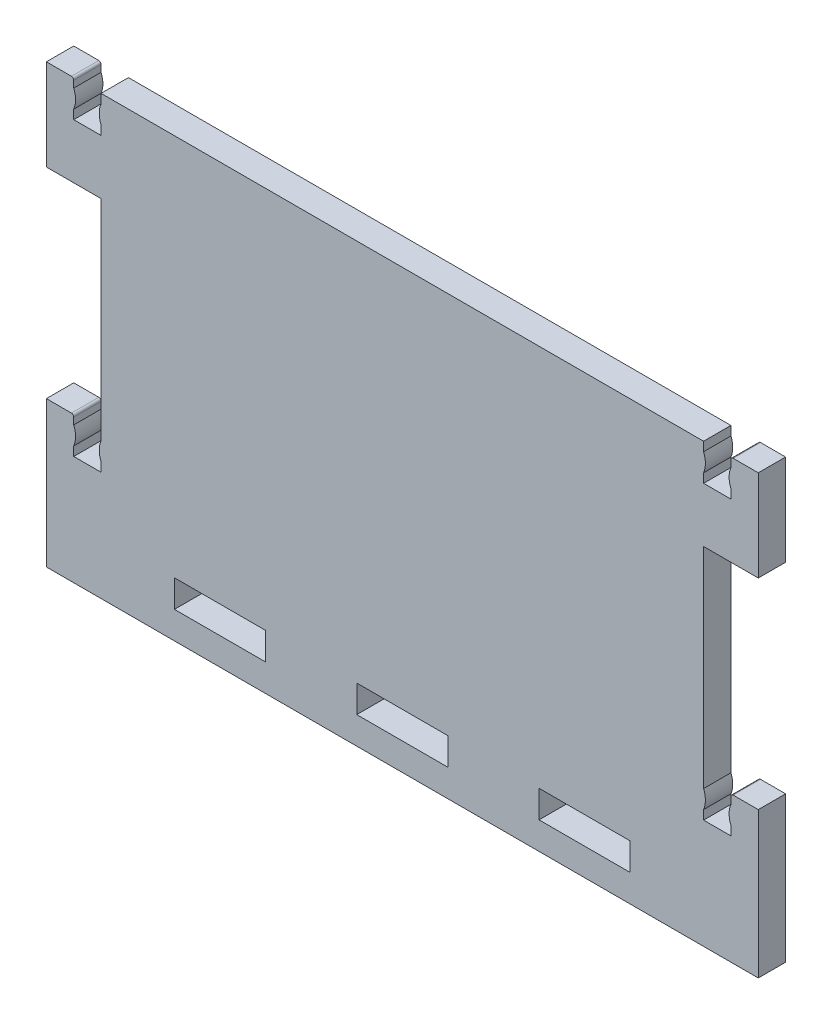
from build123d import *

# Parameters (mm, degrees)
SKETCH1_W           = 10
SKETCH1_H           = 3
BOSS_EXTRUDE1_DEPTH = 3
FILLET1_R           = 0.25


with BuildPart() as part:
    # Sketch1 → Boss-Extrude1 (new body)
    with BuildSketch(Plane.XY):
        with BuildLine():
            Line((34.843392212, -14.218278754), (31.843392212, -14.218278754))
            Line((31.843392212, -14.218278754), (31.843392212, -13.218278754))
            ThreePointArc((31.843392212, -13.218278754), (32.043392212, -12.218278754), (31.843392212, -11.218278754))
            Line((31.843392212, -11.218278754), (31.843392212, 11.781721246))
            Line((31.843392212, 11.781721246), (37.843392212, 11.781721246))
            Line((37.843392212, 11.781721246), (37.843392212, 21.781721246))
            Line((37.843392212, 21.781721246), (34.843392212, 21.781721246))
            Line((34.843392212, 21.781721246), (34.843392212, 20.781721246))
            ThreePointArc((34.843392212, 20.781721246), (34.643392212, 19.781721246), (34.843392212, 18.781721246))
            Line((34.843392212, 18.781721246), (34.843392212, 17.781721246))
            Line((34.843392212, 17.781721246), (31.843392212, 17.781721246))
            Line((31.843392212, 17.781721246), (31.843392212, 18.781721246))
            ThreePointArc((31.843392212, 18.781721246), (32.043392212, 19.781721246), (31.843392212, 20.781721246))
            Line((31.843392212, 20.781721246), (31.843392212, 21.781721246))
            Line((31.843392212, 21.781721246), (-34.256607788, 21.781721246))
            Line((-34.256607788, 21.781721246), (-34.256607788, 20.781721246))
            ThreePointArc((-34.256607788, 20.781721246), (-34.456607788, 19.781721246), (-34.256607788, 18.781721246))
            Line((-34.256607788, 18.781721246), (-34.256607788, 17.781721246))
            Line((-34.256607788, 17.781721246), (-37.256607788, 17.781721246))
            Line((-37.256607788, 17.781721246), (-37.256607788, 18.781721246))
            ThreePointArc((-37.256607788, 18.781721246), (-37.056607788, 19.781721246), (-37.256607788, 20.781721246))
            Line((-37.256607788, 20.781721246), (-37.256607788, 21.781721246))
            Line((-37.256607788, 21.781721246), (-40.256607788, 21.781721246))
            Line((-40.256607788, 21.781721246), (-40.256607788, 11.781721246))
            Line((-40.256607788, 11.781721246), (-34.256607788, 11.781721246))
            Line((-34.256607788, 11.781721246), (-34.256607788, -11.218278754))
            ThreePointArc((-34.256607788, -11.218278754), (-34.456607788, -12.218278754), (-34.256607788, -13.218278754))
            Line((-34.256607788, -13.218278754), (-34.256607788, -14.218278754))
            Line((-34.256607788, -14.218278754), (-37.256607788, -14.218278754))
            Line((-37.256607788, -14.218278754), (-37.256607788, -13.218278754))
            ThreePointArc((-37.256607788, -13.218278754), (-37.056607788, -12.218278754), (-37.256607788, -11.218278754))
            Line((-37.256607788, -11.218278754), (-37.256607788, -10.218278754))
            Line((-37.256607788, -10.218278754), (-40.256607788, -10.218278754))
            Line((-40.256607788, -10.218278754), (-40.256607788, -26.218278754))
            Line((-40.256607788, -26.218278754), (37.843392212, -26.218278754))
            Line((37.843392212, -26.218278754), (37.843392212, -10.218278754))
            Line((37.843392212, -10.218278754), (34.843392212, -10.218278754))
            Line((34.843392212, -10.218278754), (34.843392212, -11.218278754))
            ThreePointArc((34.843392212, -11.218278754), (34.643392212, -12.218278754), (34.843392212, -13.218278754))
            Line((34.843392212, -13.218278754), (34.843392212, -14.218278754))
        make_face()
        with Locations((-1.206607788, -21.718278754)):
            Rectangle(SKETCH1_W, SKETCH1_H, mode=Mode.SUBTRACT)
        with Locations((18.793392212, -21.718278754)):
            Rectangle(SKETCH1_W, SKETCH1_H, mode=Mode.SUBTRACT)
        with Locations((-21.206607788, -21.718278754)):
            Rectangle(SKETCH1_W, SKETCH1_H, mode=Mode.SUBTRACT)
    extrude(amount=BOSS_EXTRUDE1_DEPTH)

    # Fillet1
    fillet1_edges = [part.edges().sort_by_distance(p)[0] for p in [
        (34.843392212, 21.781721246, 1.5),
        (34.843392212, -10.218278754, 1.5),
        (-37.256607788, -10.218278754, 1.5),
        (-37.256607788, 21.781721246, 1.5),
    ]]
    fillet(fillet1_edges, radius=FILLET1_R)


solid = part.part
